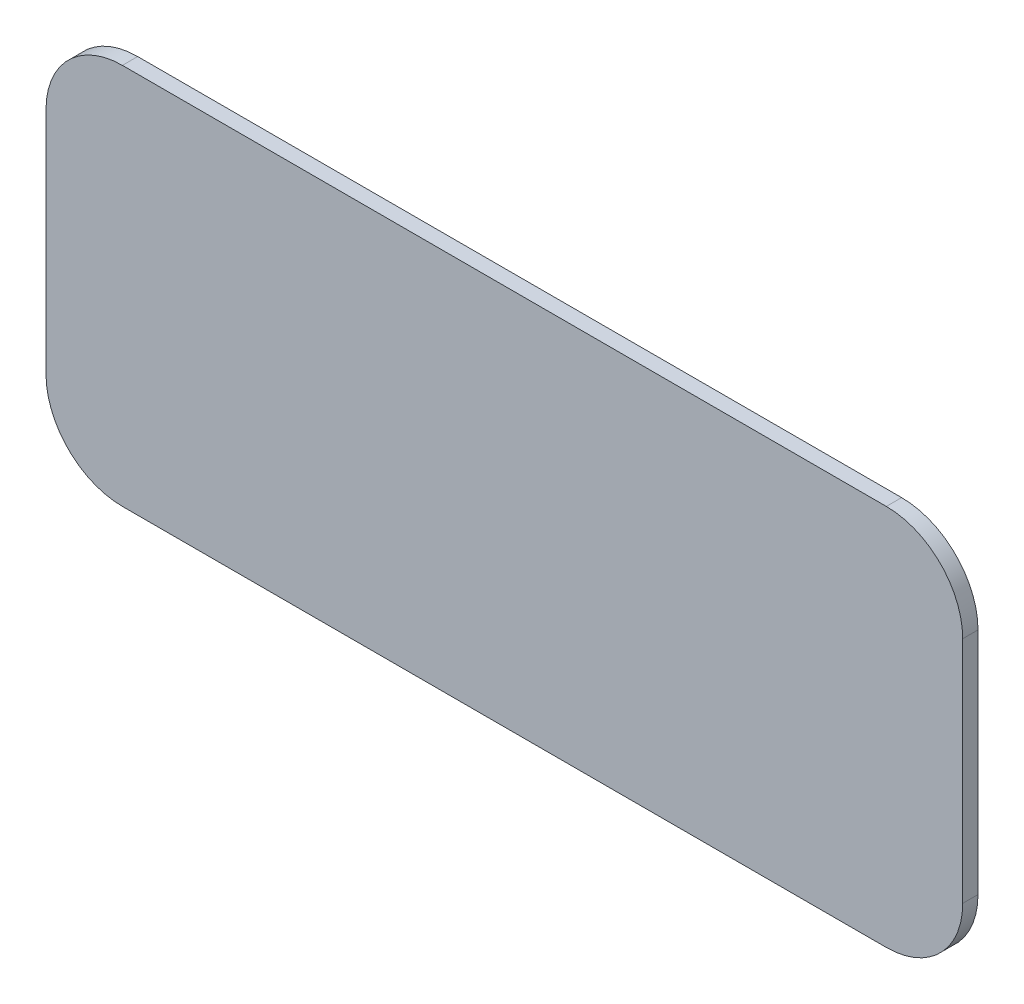
from build123d import *

# Parameters (mm, degrees)
BOSS_EXTRUDE1_DEPTH = 2


with BuildPart() as part:
    # Sketch1 → Boss-Extrude1 (new body)
    with BuildSketch(Plane.XY):
        with BuildLine():
            Line((50, 28.007283518), (-50, 28.007283518))
            ThreePointArc((-50, 28.007283518), (-57.071067812, 25.07835133), (-60, 18.007283518))
            Line((-60, 18.007283518), (-60, -11.992716482))
            ThreePointArc((-60, -11.992716482), (-57.071067812, -19.063784293), (-50, -21.992716482))
            Line((-50, -21.992716482), (50, -21.992716482))
            ThreePointArc((50, -21.992716482), (57.071067812, -19.063784293), (60, -11.992716482))
            Line((60, -11.992716482), (60, 18.007283518))
            ThreePointArc((60, 18.007283518), (57.071067812, 25.07835133), (50, 28.007283518))
        make_face()
    extrude(amount=BOSS_EXTRUDE1_DEPTH)


solid = part.part
